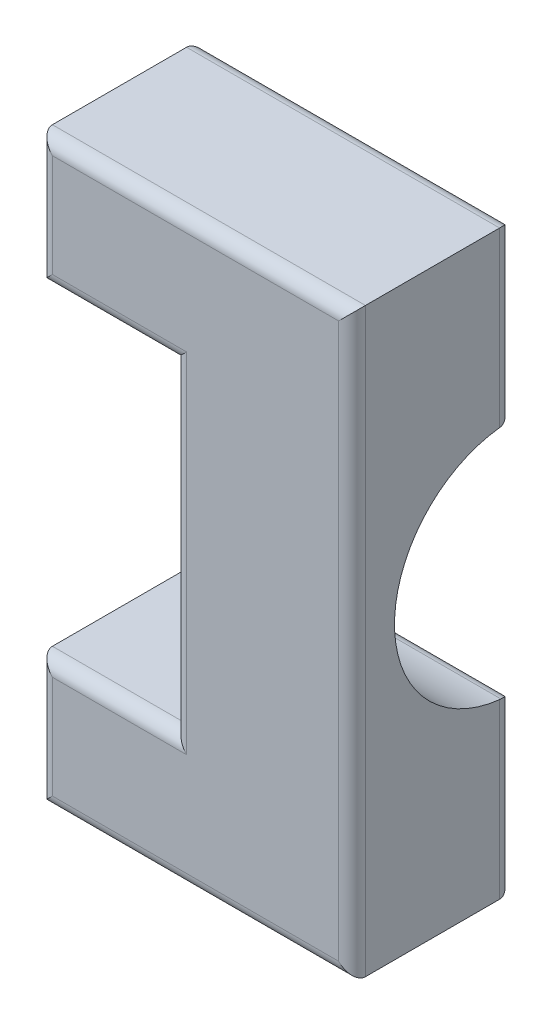
from build123d import *

# Parameters (mm, degrees)
EXTRUDE_1_DEPTH     = 18
SKETCH_2_R          = 13.25
CUT_EXTRUDE_1_DEPTH = 76.986840966
FILLET_1_R          = 1.5


with BuildPart() as part:
    # ｽｹｯﾁ1 → ﾎﾞｽ - 押し出し1 (new body)
    with BuildSketch(Plane.XY):
        Polygon((0, 0), (0, 14.5), (15, 14.5), (15, 50.5), (0, 50.5), (0, 65), (35, 65), (35, 0), align=None)
    extrude(amount=EXTRUDE_1_DEPTH)

    # ｽｹｯﾁ2 → ｶｯﾄ - 押し出し1 (cut, through all)
    with BuildSketch(Plane.ZY):
        with Locations((0, 32.5)):
            Circle(SKETCH_2_R)
    extrude(amount=-CUT_EXTRUDE_1_DEPTH, mode=Mode.SUBTRACT)

    # ﾌｨﾚｯﾄ1
    fillet_1_edges = [part.edges().sort_by_distance(p)[0] for p in [
        (0, 57.75, 0),
        (17.5, 65, 0),
        (7.5, 14.5, 18),
        (35, 55.375, 0),
        (17.5, 0, 0),
        (0, 7.25, 0),
        (7.5, 14.5, 0),
        (15, 16.875, 0),
        (0, 7.25, 18),
        (17.5, 0, 18),
        (35, 32.5, 18),
        (15, 48.125, 0),
        (35, 9.625, 0),
        (25, 19.25, 0),
        (25, 45.75, 0),
        (17.5, 65, 18),
        (15, 32.5, 13.25),
        (0, 57.75, 18),
        (7.5, 50.5, 18),
        (15, 32.5, 18),
        (7.5, 50.5, 0),
    ]]
    fillet(fillet_1_edges, radius=FILLET_1_R)


solid = part.part
